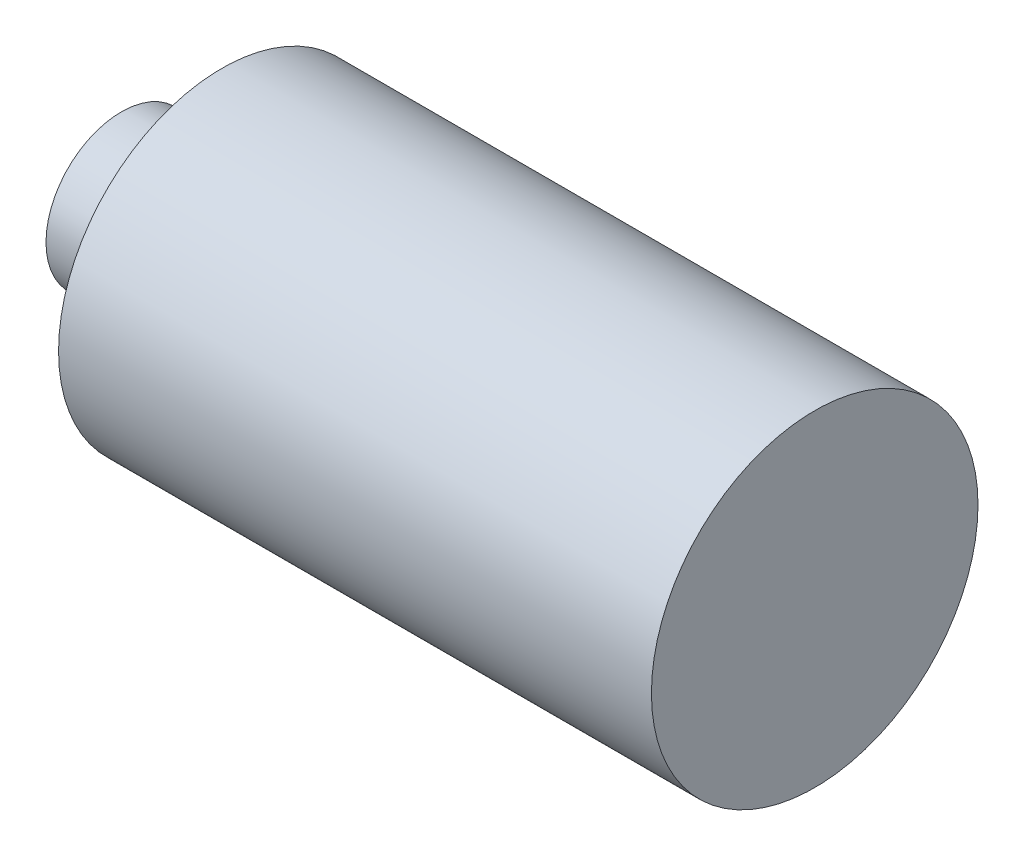
from build123d import *


with BuildPart() as part:
    # Sketch1 → Revolve1 (revolve)
    with BuildSketch(Plane.XY, mode=Mode.PRIVATE) as revolve1_sk:
        Polygon((11.8, 0), (11.8, 3.25), (0, 3.25), (0, 1.5), (-2, 1.5), (-2, 0), align=None)
    revolve(revolve1_sk.sketch.rotate(Axis((-14.130434783, 0, 0), (1, 0, 0)), 90), axis=Axis((-14.130434783, 0, 0), (1, 0, 0)))


solid = part.part
